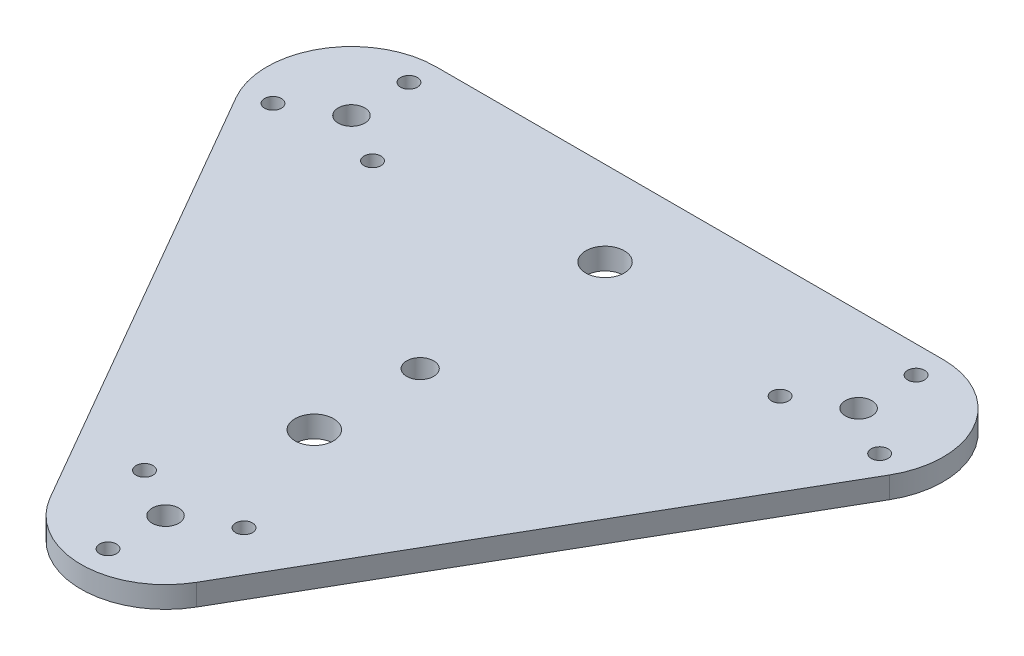
from build123d import *

# Parameters (mm, degrees)
ESQUISSE1_R             = 5.7
ESQUISSE1_R_2           = 3.925
BOSS_EXTRU_1_DEPTH      = 6.35
ESQUISSE4_R             = 2.5
ENL_V_MAT_EXTRU_1_DEPTH = 6.35
ESQUISSE5_R             = 4
ENL_V_MAT_EXTRU_2_DEPTH = 135.686014493
ESQUISSE6_R             = 5.7
ENL_V_MAT_EXTRU_3_DEPTH = 135.686014493


with BuildPart() as part:
    # Esquisse1 → Boss.-Extru.1 (new body)
    with BuildSketch(Plane(origin=(0, 0, 0), x_dir=(1, 0, 0), z_dir=(0, 1, 0))):
        with BuildLine():
            Line((-96.654639651, 52.506938663), (-21.654639651, -77.493061337))
            ThreePointArc((-21.654639651, -77.493061337), (0, -90), (21.654639651, -77.493061337))
            Line((21.654639651, -77.493061337), (96.654639651, 52.506938663))
            ThreePointArc((96.654639651, 52.506938663), (96.648631983, 77.50346885), (75, 90))
            Line((75, 90), (-75, 90))
            ThreePointArc((-75, 90), (-96.648631983, 77.50346885), (-96.654639651, 52.506938663))
        make_face()
        with Locations(Location((0, 65, 0), (0, 0, 270))):
            Circle(ESQUISSE1_R, mode=Mode.SUBTRACT)
        with Locations(Location((-75, 65, 0), (0, 0, 270))):
            Circle(ESQUISSE1_R_2, mode=Mode.SUBTRACT)
        with Locations(Location((75, 65, 0), (0, 0, 270))):
            Circle(ESQUISSE1_R_2, mode=Mode.SUBTRACT)
        with Locations(Location((0, -65, 0), (0, 0, 270))):
            Circle(ESQUISSE1_R_2, mode=Mode.SUBTRACT)
    extrude(amount=BOSS_EXTRU_1_DEPTH)

    # Esquisse4 → Enlèv. mat.-Extru.1 (cut)
    with BuildSketch(Plane.XZ):
        with Locations(Location((-75, -82, 0), (0, 0, 90))):
            Circle(ESQUISSE4_R)
        with Locations(Location((-89.722431864, -56.5, 0), (0, 0, 90))):
            Circle(ESQUISSE4_R)
        with Locations(Location((-60.277568136, -56.5, 0), (0, 0, 90))):
            Circle(ESQUISSE4_R)
        with Locations(Location((60.27903399, -56.499154304, 0), (0, 0, 90))):
            Circle(ESQUISSE4_R)
        with Locations(Location((75.001465855, -81.999154304, 0), (0, 0, 90))):
            Circle(ESQUISSE4_R)
        with Locations(Location((89.723897719, -56.499154304, 0), (0, 0, 90))):
            Circle(ESQUISSE4_R)
        with Locations(Location((14.722431864, 56.5, 0), (0, 0, 90))):
            Circle(ESQUISSE4_R)
        with Locations(Location((0, 82, 0), (0, 0, 90))):
            Circle(ESQUISSE4_R)
        with Locations(Location((-14.722431864, 56.5, 0), (0, 0, 90))):
            Circle(ESQUISSE4_R)
    extrude(amount=-ENL_V_MAT_EXTRU_1_DEPTH, mode=Mode.SUBTRACT)

    # Esquisse5 → Enlèv. mat.-Extru.2 (cut, through all)
    with BuildSketch(Plane(origin=(0, 6.35, 0), x_dir=(1, 0, 0), z_dir=(0, 1, 0))):
        with Locations(Location((0.000849353, 10.324999995, 0), (0, 0, 270))):
            Circle(ESQUISSE5_R)
    extrude(amount=-ENL_V_MAT_EXTRU_2_DEPTH, mode=Mode.SUBTRACT)

    # Esquisse6 → Enlèv. mat.-Extru.3 (cut, through all)
    with BuildSketch(Plane(origin=(0, 6.35, 0), x_dir=(1, 0, 0), z_dir=(0, 1, 0))):
        with Locations(Location((0, -21, 0), (0, 0, 270))):
            Circle(ESQUISSE6_R)
    extrude(amount=-ENL_V_MAT_EXTRU_3_DEPTH, mode=Mode.SUBTRACT)


solid = part.part
